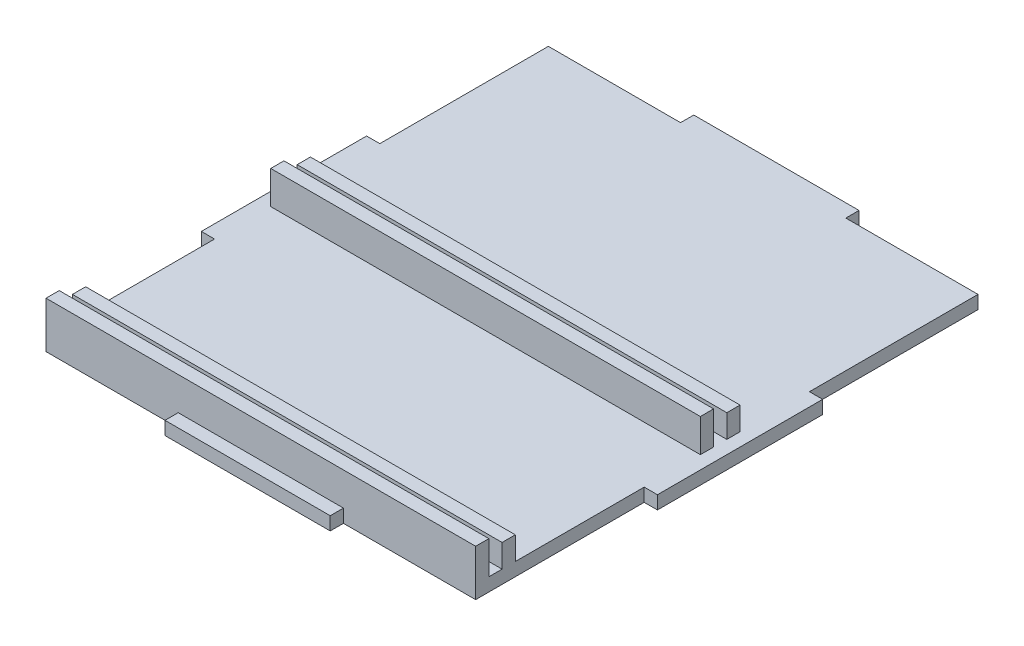
from build123d import *

# Parameters (mm, degrees)
BOSS_EXTRUDE1_DEPTH = 4
SKETCH4_W           = 130
SKETCH4_H           = 4
BOSS_EXTRUDE2_DEPTH = 10
SKETCH5_W           = 130
SKETCH5_H           = 4
BOSS_EXTRUDE3_DEPTH = 7
SKETCH6_W           = 130
SKETCH6_H           = 4
BOSS_EXTRUDE4_DEPTH = 10
SKETCH7_W           = 130
SKETCH7_H           = 4
BOSS_EXTRUDE5_DEPTH = 7


with BuildPart() as part:
    # Sketch3 → Boss-Extrude1 (new body)
    with BuildSketch(Plane(origin=(0, 0, 0), x_dir=(1, 0, 0), z_dir=(0, 1, 0))):
        Polygon((-25, 80), (25, 80), (25, 76), (65, 76), (65, 25), (69, 25), (69, -25), (65, -25), (65, -76), (25, -76), (25, -80), (-25, -80), (-25, -76), (-65, -76), (-65, -25), (-69, -25), (-69, 25), (-65, 25), (-65, 76), (-25, 76), align=None)
    extrude(amount=BOSS_EXTRUDE1_DEPTH)

    # Sketch4 → Boss-Extrude2 (add)
    with BuildSketch(Plane(origin=(0, 4, 0), x_dir=(1, 0, 0), z_dir=(0, 1, 0))):
        with Locations((0, -74)):
            Rectangle(SKETCH4_W, SKETCH4_H)
    extrude(amount=BOSS_EXTRUDE2_DEPTH)

    # Sketch5 → Boss-Extrude3 (add)
    with BuildSketch(Plane(origin=(0, 4, 0), x_dir=(1, 0, 0), z_dir=(0, 1, 0))):
        with Locations((0, -66)):
            Rectangle(SKETCH5_W, SKETCH5_H)
    extrude(amount=BOSS_EXTRUDE3_DEPTH)

    # Sketch6 → Boss-Extrude4 (add)
    with BuildSketch(Plane(origin=(0, 4, 0), x_dir=(1, 0, 0), z_dir=(0, 1, 0))):
        with Locations((0, -6)):
            Rectangle(SKETCH6_W, SKETCH6_H)
    extrude(amount=BOSS_EXTRUDE4_DEPTH)

    # Sketch7 → Boss-Extrude5 (add)
    with BuildSketch(Plane(origin=(0, 4, 0), x_dir=(1, 0, 0), z_dir=(0, 1, 0))):
        with Locations((0, 2)):
            Rectangle(SKETCH7_W, SKETCH7_H)
    extrude(amount=BOSS_EXTRUDE5_DEPTH)


solid = part.part
